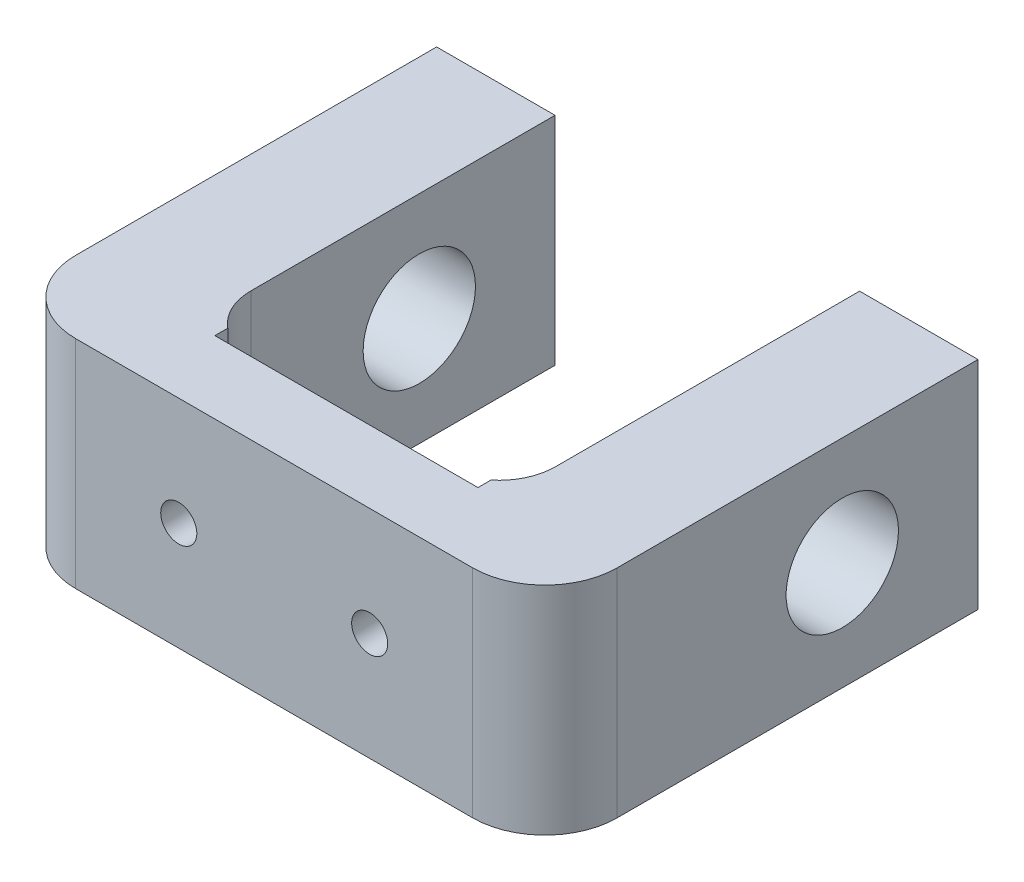
from build123d import *

# Parameters (mm, degrees)
BOSS_EXTRUDE1_DEPTH     = 38.1
SKETCH2_R               = 9.8806
CUT_EXTRUDE1_DEPTH      = 128.791284914
CUT_EXTRUDE2_DEPTH      = 89.045446362
CUT_EXTRUDE2_DEPTH_BACK = 89.045446362
SKETCH3_R               = 3.175
SKETCH4_W               = 46.294
SKETCH4_H               = 2.54
CUT_EXTRUDE3_DEPTH      = 98.602206085


with BuildPart() as part:
    # Sketch1 → Boss-Extrude1 (new body)
    with BuildSketch(Plane(origin=(0, 0, 0), x_dir=(1, 0, 0), z_dir=(0, 1, 0))):
        with BuildLine():
            Line((-47.625, 76.2), (-47.625, 12.7))
            ThreePointArc((-47.625, 12.7), (-43.905256121, 3.719743879), (-34.925, 0))
            Line((-34.925, 0), (34.925, 0))
            ThreePointArc((34.925, 0), (43.905256121, 3.719743879), (47.625, 12.7))
            Line((47.625, 12.7), (47.625, 76.2))
            Line((47.625, 76.2), (26.797, 76.2))
            Line((26.797, 76.2), (26.797, 22.7))
            ThreePointArc((26.797, 22.7), (23.868067812, 15.628932188), (16.797, 12.7))
            Line((16.797, 12.7), (-16.797, 12.7))
            ThreePointArc((-16.797, 12.7), (-23.868067812, 15.628932188), (-26.797, 22.7))
            Line((-26.797, 22.7), (-26.797, 76.2))
            Line((-26.797, 76.2), (-47.625, 76.2))
        make_face()
    extrude(amount=BOSS_EXTRUDE1_DEPTH)

    # Sketch2 → Cut-Extrude1 (cut, through all)
    with BuildSketch(Plane(origin=(47.625, 0, 0), x_dir=(0, 0, -1), z_dir=(1, 0, 0))):
        with Locations((52.324, 19.05)):
            Circle(SKETCH2_R)
    extrude(amount=-CUT_EXTRUDE1_DEPTH, mode=Mode.SUBTRACT)

    # Sketch3 → Cut-Extrude2 (cut, two sides: drawn at the far end of the back side and taken through both)
    with BuildSketch(Plane(origin=(0, 0, -12.7), x_dir=(-1, 0, 0), z_dir=(0, 0, -1)).offset(-CUT_EXTRUDE2_DEPTH_BACK)):
        with Locations((-16.797, 19.05)):
            Circle(SKETCH3_R)
        with Locations((16.797, 19.05)):
            Circle(SKETCH3_R)
    extrude(amount=CUT_EXTRUDE2_DEPTH + CUT_EXTRUDE2_DEPTH_BACK, mode=Mode.SUBTRACT)

    # Sketch4 → Cut-Extrude3 (cut, through all)
    with BuildSketch(Plane.XZ):
        with Locations((0, -13.97)):
            Rectangle(SKETCH4_W, SKETCH4_H)
    extrude(amount=-CUT_EXTRUDE3_DEPTH, mode=Mode.SUBTRACT)


solid = part.part
